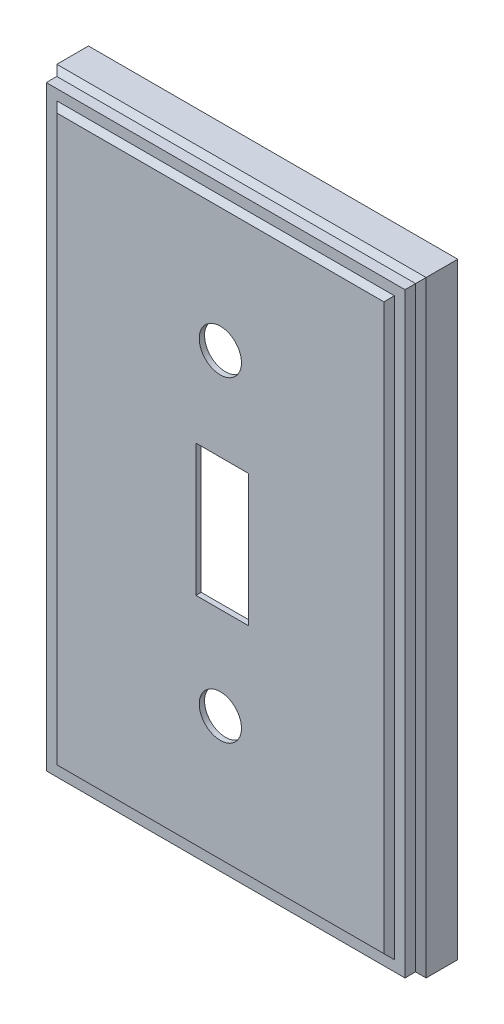
from build123d import *

# Parameters (mm, degrees)
SKETCH1_W           = 70
SKETCH1_H           = 115
BOSS_EXTRUDE1_DEPTH = 10
SHELL2_T            = -1
SKETCH2_R           = 4
SKETCH2_W           = 10
SKETCH2_H           = 25
CUT_EXTRUDE1_DEPTH  = 10
CHAMFER1_SIZE       = 4


with BuildPart() as part:
    # Sketch1 → Boss-Extrude1 (new body)
    with BuildSketch(Plane.XY):
        with Locations((35, -57.5)):
            Rectangle(SKETCH1_W, SKETCH1_H)
    extrude(amount=BOSS_EXTRUDE1_DEPTH)

    # Shell2
    shell2_openings = [part.faces().sort_by_distance(p)[0] for p in [
        (35, -57.5, 0),
    ]]
    offset(amount=SHELL2_T, openings=shell2_openings, kind=Kind.INTERSECTION)

    # Sketch2 → Cut-Extrude1 (cut)
    with BuildSketch(Plane.XY.offset(10)):
        with Locations((35, -27.5)):
            Circle(SKETCH2_R)
        with Locations((35, -87.5)):
            Circle(SKETCH2_R)
        with Locations((35.369677272, -57.5)):
            Rectangle(SKETCH2_W, SKETCH2_H)
    extrude(amount=-CUT_EXTRUDE1_DEPTH, mode=Mode.SUBTRACT)

    # Chamfer1
    chamfer1_edges = [part.edges().sort_by_distance(p)[0] for p in [
        (70, -57.5, 10),
        (35, 0, 10),
        (0, -57.5, 10),
        (35, -115, 10),
    ]]
    chamfer(chamfer1_edges, length=CHAMFER1_SIZE)


solid = part.part
